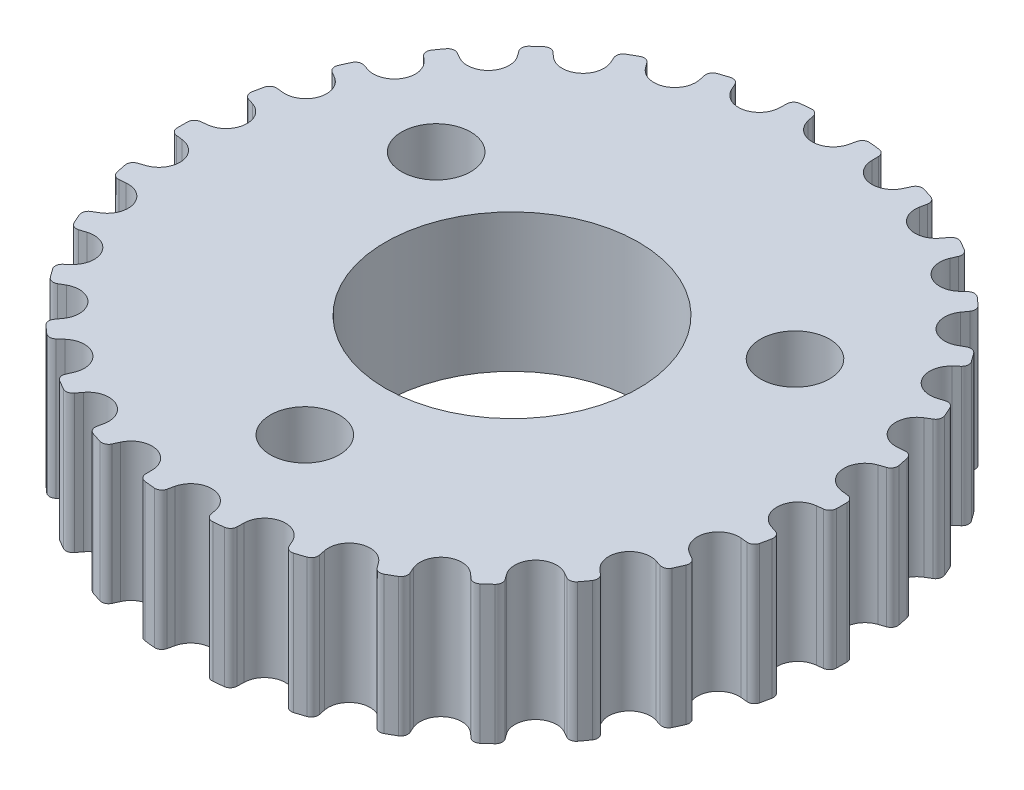
from build123d import *

# Parameters (mm, degrees)
SKETCH1_R           = 14.323944878
BOSS_EXTRUDE1_DEPTH = 6
CUT_EXTRUDE1_DEPTH  = 22.127015732
CIRPATTERN1_COUNT   = 30
SKETCH3_R           = 5.5
CUT_EXTRUDE2_DEPTH  = 22.08964236
SKETCH4_R           = 1.5
CUT_EXTRUDE3_DEPTH  = 22.08964236


with BuildPart() as part:
    # Sketch1 → Boss-Extrude1 (new body)
    with BuildSketch(Plane(origin=(0, 0, 0), x_dir=(1, 0, 0), z_dir=(0, 1, 0))):
        with Locations(Location((0, 0, 0), (0, 0, 270))):
            Circle(SKETCH1_R)
    extrude(amount=BOSS_EXTRUDE1_DEPTH)

    # Sketch2 → Cut-Extrude1 (cut, through all)
    with BuildSketch(Plane(origin=(0, 6, 0), x_dir=(1, 0, 0), z_dir=(0, 1, 0))):
        with BuildLine():
            Line((-0.88830444, 13.756422166), (-0.95, 14.033881093))
            ThreePointArc((-0.95, 14.033881093), (-1.065709647, 14.210883809), (-1.269434594, 14.267583281))
            ThreePointArc((-1.269434594, 14.267583281), (-2.127648488, 14.165045315), (-2.978115599, 14.010932316))
            Line((-2.978115599, 14.010932316), (-2.978115599, 14.323944878))
            Line((-2.978115599, 14.323944878), (2.978115599, 14.323944878))
            Line((2.978115599, 14.323944878), (2.978115599, 14.010932316))
            ThreePointArc((2.978115599, 14.010932316), (2.127648488, 14.165045315), (1.269434594, 14.267583281))
            ThreePointArc((1.269434594, 14.267583281), (1.065709647, 14.210883809), (0.95, 14.033881093))
            Line((0.95, 14.033881093), (0.88830444, 13.756422166))
            ThreePointArc((0.88830444, 13.756422166), (0, 13.043944878), (-0.88830444, 13.756422166))
        make_face()
    cut_extrude1 = extrude(amount=-CUT_EXTRUDE1_DEPTH, mode=Mode.SUBTRACT)

    # CirPattern1: Cut-Extrude1 ×30 about axis
    cirpattern1_axis = Axis((0, 0, 0), (0, 1, 0))
    for i in range(1, CIRPATTERN1_COUNT):
        add(cut_extrude1.rotate(cirpattern1_axis, i * 360 / CIRPATTERN1_COUNT), mode=Mode.SUBTRACT)

    # Sketch3 → Cut-Extrude2 (cut, through all)
    with BuildSketch(Plane.XZ):
        with Locations(Location((0, 0, 0), (0, 0, 270))):
            Circle(SKETCH3_R)
    extrude(amount=-CUT_EXTRUDE2_DEPTH, mode=Mode.SUBTRACT)

    # Sketch4 → Cut-Extrude3 (cut, through all)
    with BuildSketch(Plane.XZ):
        with Locations(Location((0, 9, 0), (0, 0, 270))):
            Circle(SKETCH4_R)
        with Locations(Location((7.794228634, -4.5, 0), (0, 0, 270))):
            Circle(SKETCH4_R)
        with Locations(Location((-7.794228634, -4.5, 0), (0, 0, 270))):
            Circle(SKETCH4_R)
    extrude(amount=-CUT_EXTRUDE3_DEPTH, mode=Mode.SUBTRACT)


solid = part.part
